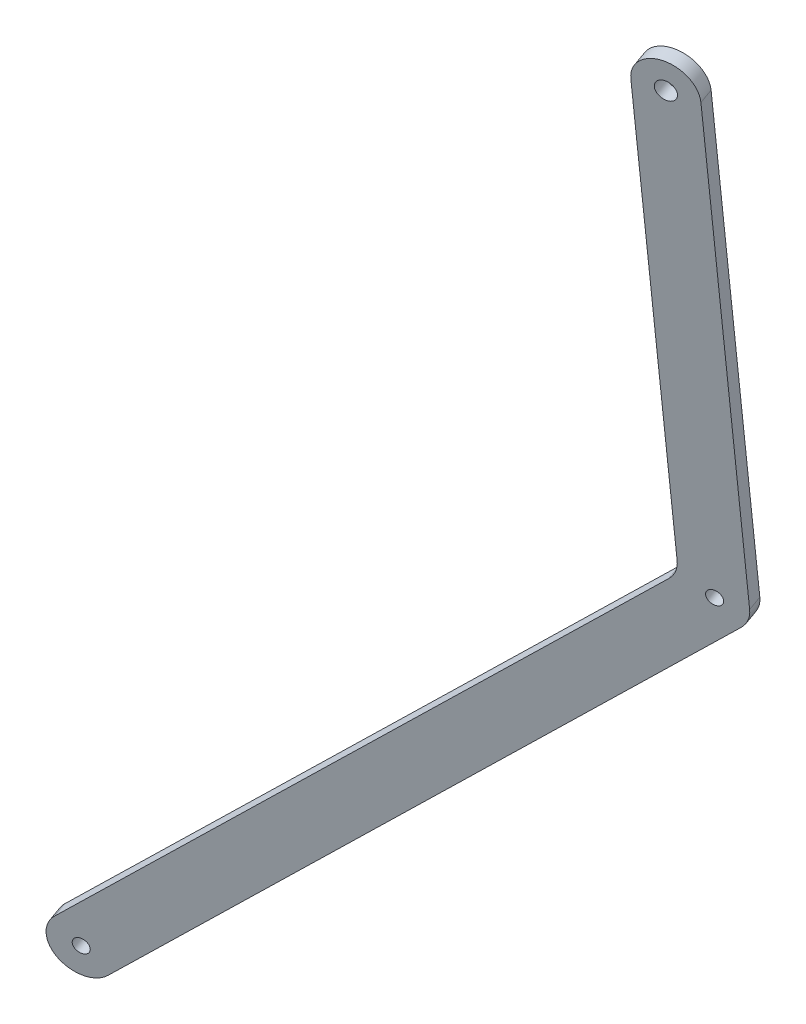
from build123d import *

# Parameters (mm, degrees)
SKETCH2_R           = 12.7
SKETCH2_R_2         = 3.2639
SKETCH2_R_3         = 4.19989
BOSS_EXTRUDE1_DEPTH = 3.175


with BuildPart() as part:
    # Sketch2 → Boss-Extrude1 (new, symmetric)
    # profile 1 of 7: a face of its own
    with BuildSketch(Plane(origin=(0, 0, 0), x_dir=(0.9683571483215458, 0.03640581426885692, -0.2468988658985399), z_dir=(0.24956849419460725, -0.14125913850417393, 0.9579986547456604))):
        with BuildLine():
            Line((242.448329145, 239.243930423), (-8.577063088, 9.366108518))
            ThreePointArc((-8.577063088, 9.366108518), (5.11670298, 11.623654787), (12.7, 0))
            ThreePointArc((12.7, 0), (11.623654787, -5.11670298), (8.577063088, -9.366108518))
            Line((8.577063088, -9.366108518), (267.433066466, 227.682636686))
            ThreePointArc((267.433066466, 227.682636686), (253.522604962, 225.522910686), (246.164904285, 237.524143805))
            Line((246.164904285, 237.524143805), (246.363634717, 242.829392073))
            Line((246.363634717, 242.829392073), (242.448329145, 239.243930423))
        make_face()
    # profile 2 of 7: a face of its own
    with BuildSketch(Plane(origin=(0, 0, 0), x_dir=(0.9683571483215458, 0.03640581426885692, -0.2468988658985399), z_dir=(0.24956849419460725, -0.14125913850417393, 0.9579986547456604))):
        Circle(SKETCH2_R)
        with Locations(Location((0, 0, 0), (0, 0, 357.892497398))):
            Circle(SKETCH2_R_2, mode=Mode.SUBTRACT)
    # profile 3 of 7: a face of its own
    with BuildSketch(Plane(origin=(0, 0, 0), x_dir=(0.9683571483215458, 0.03640581426885692, -0.2468988658985399), z_dir=(0.24956849419460725, -0.14125913850417393, 0.9579986547456604))):
        with Locations((258.856003378, 237.048745204)):
            Circle(SKETCH2_R)
        with Locations(Location((258.856003378, 237.048745204, 0), (0, 0, 357.892497398))):
            Circle(SKETCH2_R_2, mode=Mode.SUBTRACT)
    # profile 4 of 7: a face of its own
    with BuildSketch(Plane(origin=(0, 0, 0), x_dir=(0.9683571483215458, 0.03640581426885692, -0.2468988658985399), z_dir=(0.24956849419460725, -0.14125913850417393, 0.9579986547456604))):
        with BuildLine():
            Line((246.562365149, 248.134640341), (246.363634717, 242.829392073))
            Line((246.363634717, 242.829392073), (250.278940289, 246.414853723))
            ThreePointArc((250.278940289, 246.414853723), (263.972706358, 248.672399992), (271.556003378, 237.048745204))
            ThreePointArc((271.556003378, 237.048745204), (271.553777956, 236.811004245), (271.54710247, 236.573346604))
            Line((271.54710247, 236.573346604), (279.589066496, 451.259216922))
            ThreePointArc((279.589066496, 451.259216922), (266.422568803, 439.04351643), (254.206868311, 452.210014123))
            Line((254.206868311, 452.210014123), (246.562365149, 248.134640341))
        make_face()
    # profile 5 of 7: a face of its own
    with BuildSketch(Plane(origin=(0, 0, 0), x_dir=(0.9683571483215458, 0.03640581426885692, -0.2468988658985399), z_dir=(0.24956849419460725, -0.14125913850417393, 0.9579986547456604))):
        with BuildLine():
            Line((250.278940289, 246.414853723), (246.363634717, 242.829392073))
            Line((246.363634717, 242.829392073), (246.164904285, 237.524143805))
            ThreePointArc((246.164904285, 237.524143805), (247.330168859, 242.38214362), (250.278940289, 246.414853723))
        make_face()
    # profile 6 of 7: a face of its own
    with BuildSketch(Plane(origin=(0, 0, 0), x_dir=(0.9683571483215458, 0.03640581426885692, -0.2468988658985399), z_dir=(0.24956849419460725, -0.14125913850417393, 0.9579986547456604))):
        with Locations((266.897967404, 451.734615523)):
            Circle(SKETCH2_R)
        with Locations(Location((266.897967404, 451.734615523, 0), (0, 0, 357.892497398))):
            Circle(SKETCH2_R_3, mode=Mode.SUBTRACT)
    # profile 7 of 7: a face of its own
    with BuildSketch(Plane(origin=(0, 0, 0), x_dir=(0.9683571483215458, 0.03640581426885692, -0.2468988658985399), z_dir=(0.24956849419460725, -0.14125913850417393, 0.9579986547456604))):
        with BuildLine():
            ThreePointArc((246.562365149, 248.134640341), (245.397100575, 243.276640526), (242.448329145, 239.243930423))
            Line((242.448329145, 239.243930423), (246.363634717, 242.829392073))
            Line((246.363634717, 242.829392073), (246.562365149, 248.134640341))
        make_face()
    extrude(amount=BOSS_EXTRUDE1_DEPTH, both=True)


solid = part.part
